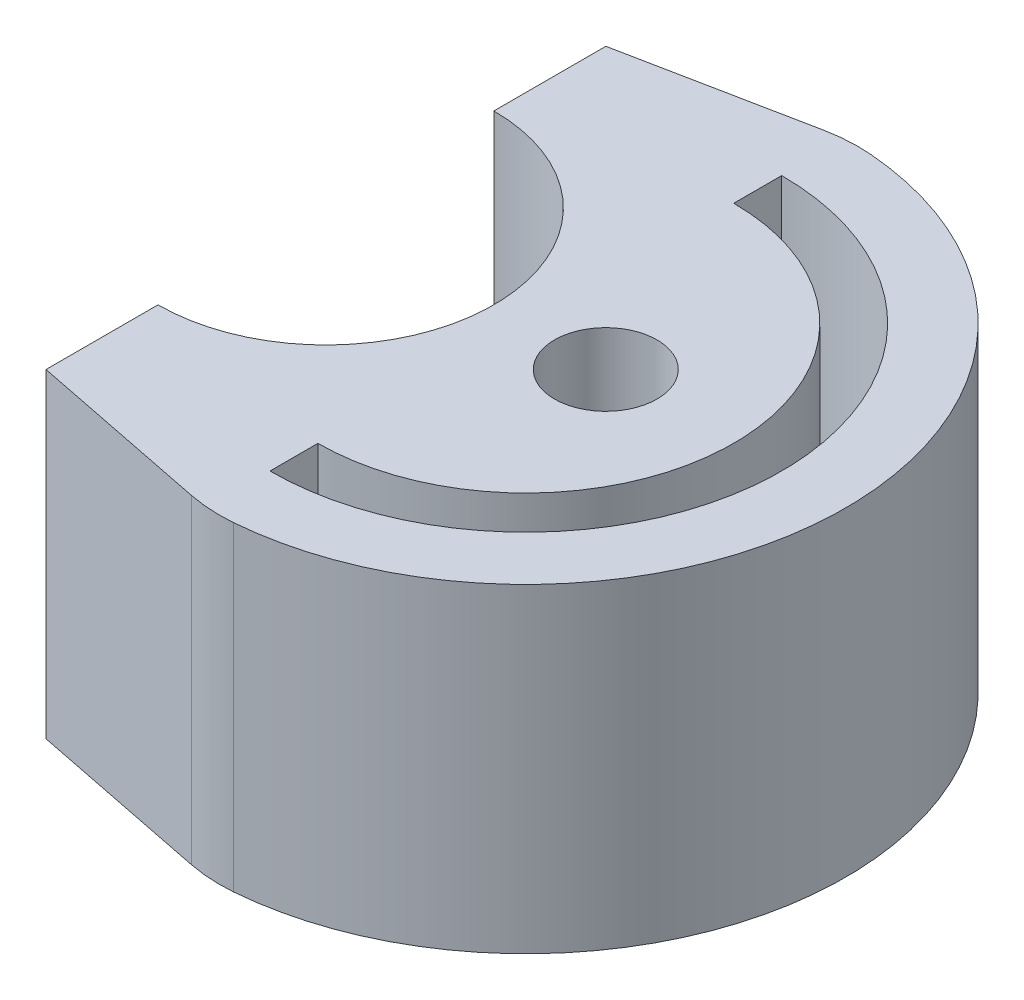
from build123d import *

# Parameters (mm, degrees)
SKETCH1_R           = 0.3207
BOSS_EXTRUDE1_DEPTH = 0.5
BOSS_EXTRUDE2_START = 0.5
SKETCH1_20_R        = 0.3207
BOSS_EXTRUDE2_DEPTH = 1.5


with BuildPart() as part:
    # Sketch1 → Boss-Extrude1 (new body)
    with BuildSketch(Plane(origin=(0, 0, 0), x_dir=(1, 0, 0), z_dir=(0, 1, 0))):
        with BuildLine():
            ThreePointArc((0.1641009, 1.993256355), (0.024548565, 1.994973575), (-0.113883759, 1.977245221))
            Line((-0.113883759, 1.977245221), (-1.25, 1.750241174))
            Line((-1.25, 1.750241174), (-1.25, 1.25))
            ThreePointArc((-1.25, 1.25), (-0.366116524, 0.883883476), (0, 0))
            ThreePointArc((0, 0), (-0.366116524, -0.883883476), (-1.25, -1.25))
            Line((-1.25, -1.25), (-1.25, -1.750241174))
            Line((-1.25, -1.750241174), (-0.11388376, -1.977245221))
            ThreePointArc((-0.11388376, -1.977245221), (0.024548564, -1.994973575), (0.164100898, -1.993256355))
            ThreePointArc((0.164100898, -1.993256355), (2, -1e-09), (0.1641009, 1.993256355))
        make_face()
        with Locations((0.5, 0)):
            Circle(SKETCH1_R, mode=Mode.SUBTRACT)
        with BuildLine():
            Line((0, 1.3), (0, 1.6))
            ThreePointArc((0, 1.6), (1.6, 0), (0, -1.6))
            Line((0, -1.6), (0, -1.3))
            ThreePointArc((0, -1.3), (1.3, 0), (0, 1.3))
        make_face(mode=Mode.SUBTRACT)
    extrude(amount=BOSS_EXTRUDE1_DEPTH)

    # Sketch1<20> → Boss-Extrude2 (add)
    with BuildSketch(Plane(origin=(0, 0, 0), x_dir=(1, 0, 0), z_dir=(0, 1, 0)).offset(BOSS_EXTRUDE2_START)):
        with BuildLine():
            ThreePointArc((0.1641009, 1.993256355), (0.024548565, 1.994973575), (-0.113883759, 1.977245221))
            Line((-0.113883759, 1.977245221), (-1.25, 1.750241174))
            Line((-1.25, 1.750241174), (-1.25, 1.05))
            ThreePointArc((-1.25, 1.05), (-0.2, 0), (-1.25, -1.05))
            Line((-1.25, -1.05), (-1.25, -1.750241174))
            Line((-1.25, -1.750241174), (-0.11388376, -1.977245221))
            ThreePointArc((-0.11388376, -1.977245221), (0.024548564, -1.994973575), (0.164100898, -1.993256355))
            ThreePointArc((0.164100898, -1.993256355), (2, -1e-09), (0.1641009, 1.993256355))
        make_face()
        with Locations((0.5, 0)):
            Circle(SKETCH1_20_R, mode=Mode.SUBTRACT)
        with BuildLine():
            Line((0, 1.3), (0, 1.6))
            ThreePointArc((0, 1.6), (1.6, 0), (0, -1.6))
            Line((0, -1.6), (0, -1.3))
            ThreePointArc((0, -1.3), (1.3, 0), (0, 1.3))
        make_face(mode=Mode.SUBTRACT)
    extrude(amount=BOSS_EXTRUDE2_DEPTH)


solid = part.part
